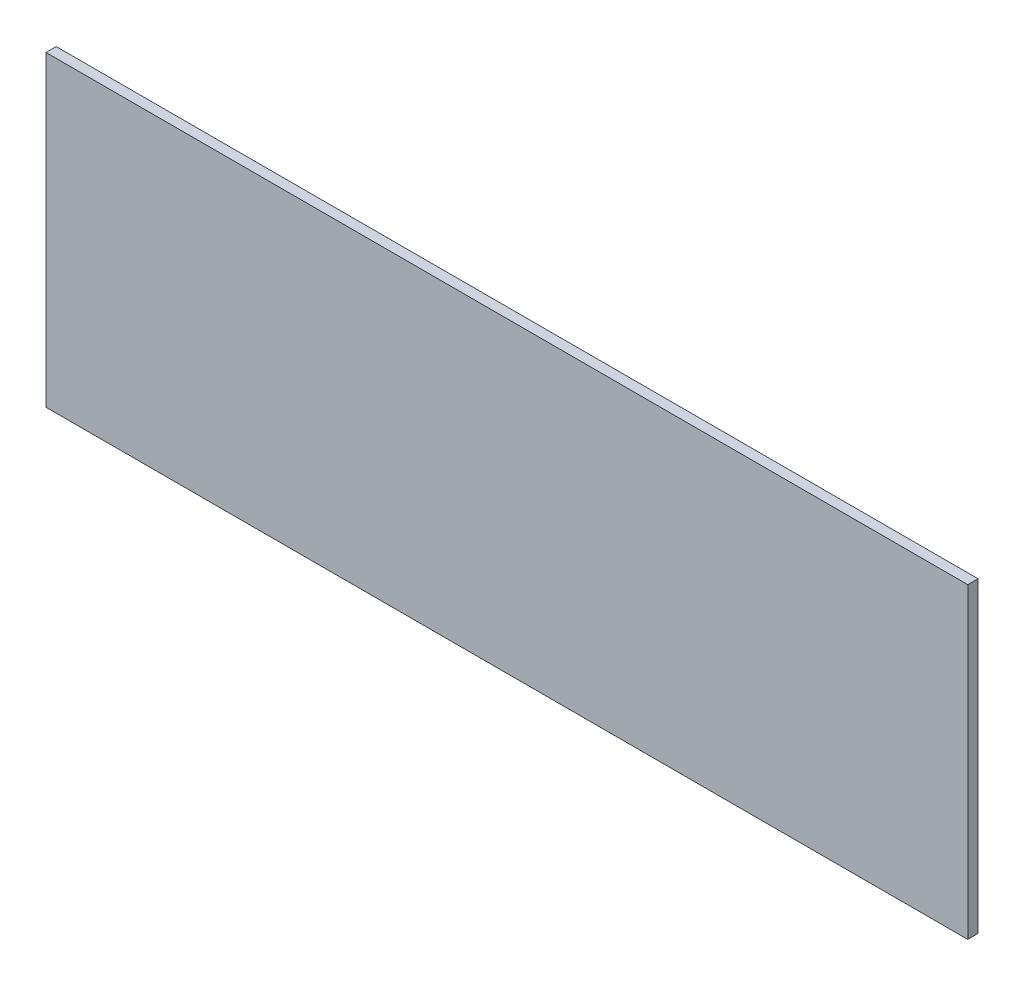
from build123d import *

# Parameters (mm, degrees)
SKETCH1_W           = 90
SKETCH1_H           = 30
BOSS_EXTRUDE1_DEPTH = 1


with BuildPart() as part:
    # Sketch1 → Boss-Extrude1 (new body)
    with BuildSketch(Plane.XY):
        with Locations((-15.254237288, 31.906779661)):
            Rectangle(SKETCH1_W, SKETCH1_H)
    extrude(amount=BOSS_EXTRUDE1_DEPTH)


solid = part.part
